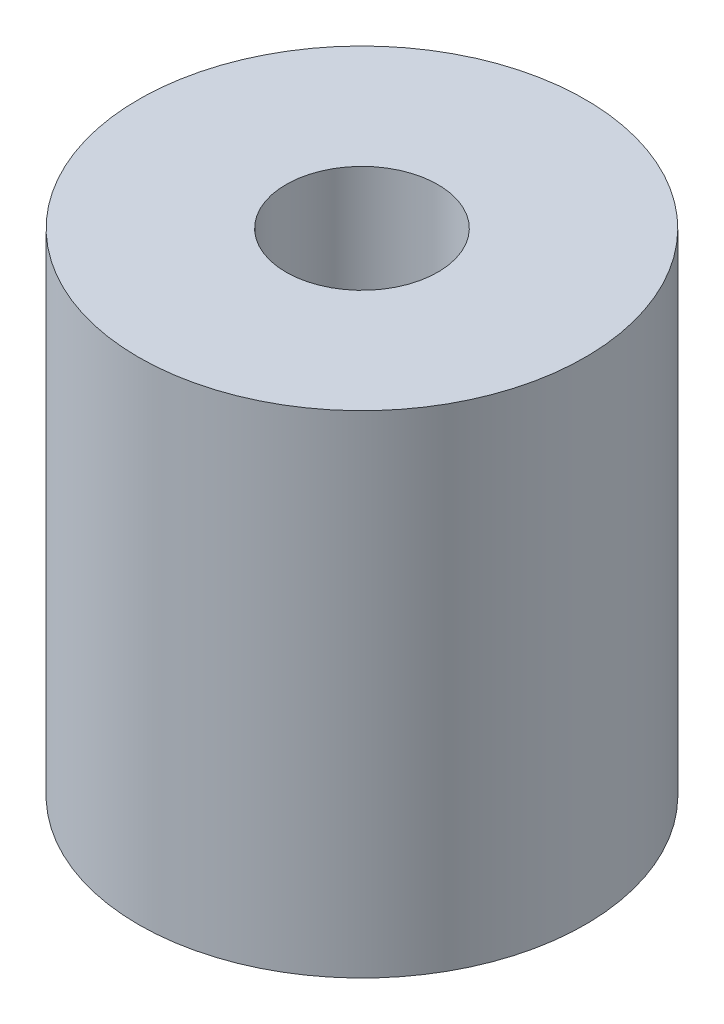
from build123d import *

# Parameters (mm, degrees)
SKETCH1_R            = 5
BOSS_EXTRUDE1_DEPTH  = 11
M3_CLEARANCE_HOLE1_D = 3.4


with BuildPart() as part:
    # Sketch1 → Boss-Extrude1 (new body)
    with BuildSketch(Plane(origin=(0, 0, 0), x_dir=(1, 0, 0), z_dir=(0, 1, 0))):
        with Locations(Location((0, 0, 0), (0, 0, 270))):
            Circle(SKETCH1_R)
    extrude(amount=BOSS_EXTRUDE1_DEPTH)

    # M3 Clearance Hole1 (through all)
    with Locations(Plane(origin=(0, 11, 0), x_dir=(1, 0, 0), z_dir=(0, 1, 0))):
        with Locations((0, 0)):
            Hole(M3_CLEARANCE_HOLE1_D / 2)


solid = part.part
